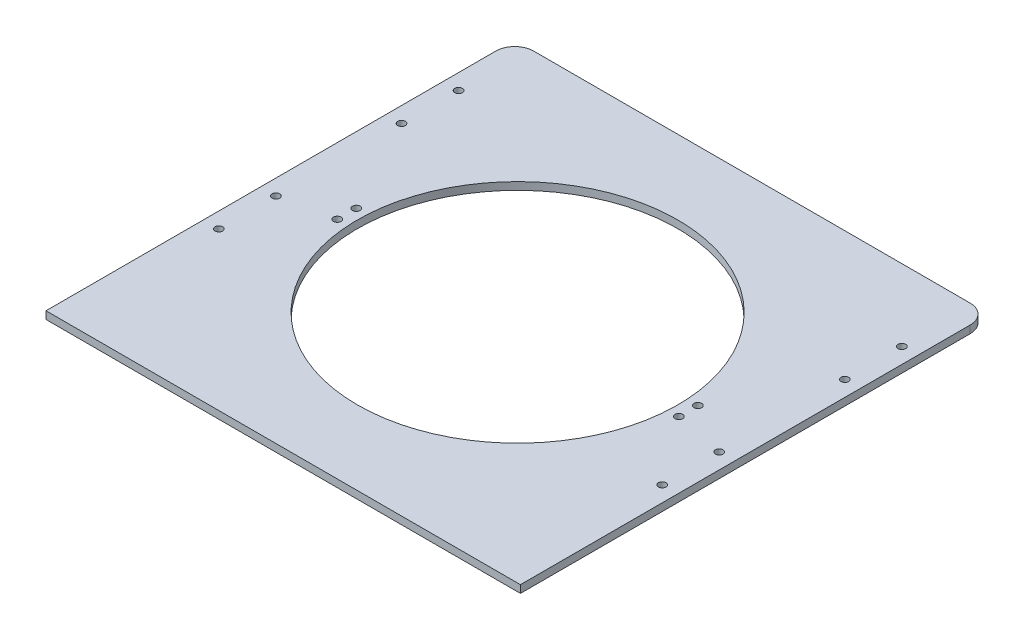
from build123d import *

# Parameters (mm, degrees)
SALIENTE_EXTRUIR1_DEPTH = 4
CROQUIS2_R              = 84.42
CROQUIS2_R_2            = 2
CORTAR_EXTRUIR1_DEPTH   = 4
CROQUIS3_R              = 2
CORTAR_EXTRUIR2_DEPTH   = 10


with BuildPart() as part:
    # Croquis1 → Saliente-Extruir1 (new body)
    with BuildSketch(Plane(origin=(0, 0, 0), x_dir=(1, 0, 0), z_dir=(0, 1, 0))):
        with BuildLine():
            Line((-125, -123.5), (125, -123.5))
            Line((125, -123.5), (125, 113.5))
            ThreePointArc((125, 113.5), (122.071067812, 120.571067812), (115, 123.5))
            Line((115, 123.5), (-115, 123.5))
            ThreePointArc((-115, 123.5), (-122.071067812, 120.571067812), (-125, 113.5))
            Line((-125, 113.5), (-125, -123.5))
        make_face()
    extrude(amount=SALIENTE_EXTRUIR1_DEPTH)

    # Croquis2 → Cortar-Extruir1 (cut)
    with BuildSketch(Plane(origin=(0, 4, 0), x_dir=(1, 0, 0), z_dir=(0, 1, 0))):
        with Locations(Location((0, 0, 0), (0, 0, 270))):
            Circle(CROQUIS2_R)
        with Locations(Location((-90, 5, 0), (0, 0, 270))):
            Circle(CROQUIS2_R_2)
        with Locations(Location((-90, -5, 0), (0, 0, 270))):
            Circle(CROQUIS2_R_2)
        with Locations(Location((90, -5, 0), (0, 0, 90))):
            Circle(CROQUIS2_R_2)
        with Locations(Location((90, 5, 0), (0, 0, 90))):
            Circle(CROQUIS2_R_2)
    extrude(amount=-CORTAR_EXTRUIR1_DEPTH, mode=Mode.SUBTRACT)

    # Croquis3 → Cortar-Extruir2 (cut)
    with BuildSketch(Plane(origin=(0, 4, 0), x_dir=(1, 0, 0), z_dir=(0, 1, 0))):
        with Locations(Location((-116.8, 85.7, 0), (0, 0, 270))):
            Circle(CROQUIS3_R)
        with Locations(Location((-116.8, 55.65, 0), (0, 0, 270))):
            Circle(CROQUIS3_R)
        with Locations(Location((-116.8, -10.55, 0), (0, 0, 270))):
            Circle(CROQUIS3_R)
        with Locations(Location((-116.8, -40.6, 0), (0, 0, 270))):
            Circle(CROQUIS3_R)
        with Locations(Location((116.8, -40.6, 0), (0, 0, 90))):
            Circle(CROQUIS3_R)
        with Locations(Location((116.8, -10.55, 0), (0, 0, 90))):
            Circle(CROQUIS3_R)
        with Locations(Location((116.8, 55.65, 0), (0, 0, 90))):
            Circle(CROQUIS3_R)
        with Locations(Location((116.8, 85.7, 0), (0, 0, 90))):
            Circle(CROQUIS3_R)
    extrude(amount=-CORTAR_EXTRUIR2_DEPTH, mode=Mode.SUBTRACT)


solid = part.part
